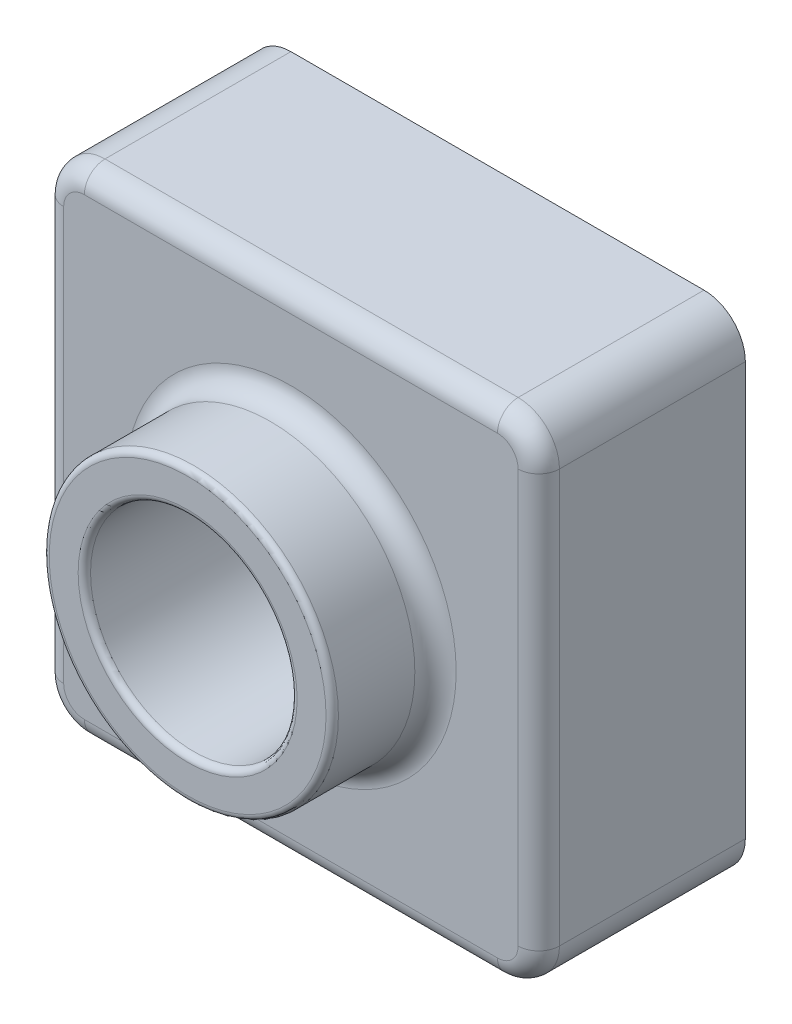
from build123d import *

# Parameters (mm, degrees)
SKETCH1_W           = 120
SKETCH1_H           = 120
BOSS_EXTRUDE1_DEPTH = 50
SKETCH2_R           = 35
BOSS_EXTRUDE2_DEPTH = 25
SKETCH3_R           = 25
CUT_EXTRUDE1_DEPTH  = 114.247516529
FILLET1_R           = 10
FILLET2_R           = 1.5
FILLET3_R           = 5
SHELL1_T            = -2


with BuildPart() as part:
    # Sketch1 → Boss-Extrude1 (new body)
    with BuildSketch(Plane.XY):
        Rectangle(SKETCH1_W, SKETCH1_H)
    extrude(amount=BOSS_EXTRUDE1_DEPTH)

    # Sketch2 → Boss-Extrude2 (add)
    with BuildSketch(Plane.XY.offset(50)):
        Circle(SKETCH2_R)
    extrude(amount=BOSS_EXTRUDE2_DEPTH)

    # Sketch3 → Cut-Extrude1 (cut, through all)
    with BuildSketch(Plane.XY.offset(75)):
        Circle(SKETCH3_R)
    extrude(amount=-CUT_EXTRUDE1_DEPTH, mode=Mode.SUBTRACT)

    # Fillet1
    fillet1_edges = [part.edges().sort_by_distance(p)[0] for p in [
        (-60, 60, 25),
        (60, 60, 25),
        (60, -60, 25),
        (-60, -60, 25),
    ]]
    fillet(fillet1_edges, radius=FILLET1_R)

    # Fillet2
    fillet2_edges = [part.edges().sort_by_distance(p)[0] for p in [
        (-35, 0, 75),
        (-25, 0, 75),
    ]]
    fillet(fillet2_edges, radius=FILLET2_R)

    # Fillet3
    fillet3_edges = [part.edges().sort_by_distance(p)[0] for p in [
        (-35, 0, 50),
        (0, -60, 50),
        (-60, 0, 50),
        (60, 0, 50),
        (0, 60, 50),
        (57.071067812, -57.071067812, 50),
        (57.071067812, 57.071067812, 50),
        (-57.071067812, 57.071067812, 50),
        (-57.071067812, -57.071067812, 50),
    ]]
    fillet(fillet3_edges, radius=FILLET3_R)

    # Shell1
    shell1_openings = [part.faces().sort_by_distance(p)[0] for p in [
        (0, -58.302943725, 0),
    ]]
    offset(amount=SHELL1_T, openings=shell1_openings, kind=Kind.INTERSECTION)


solid = part.part
